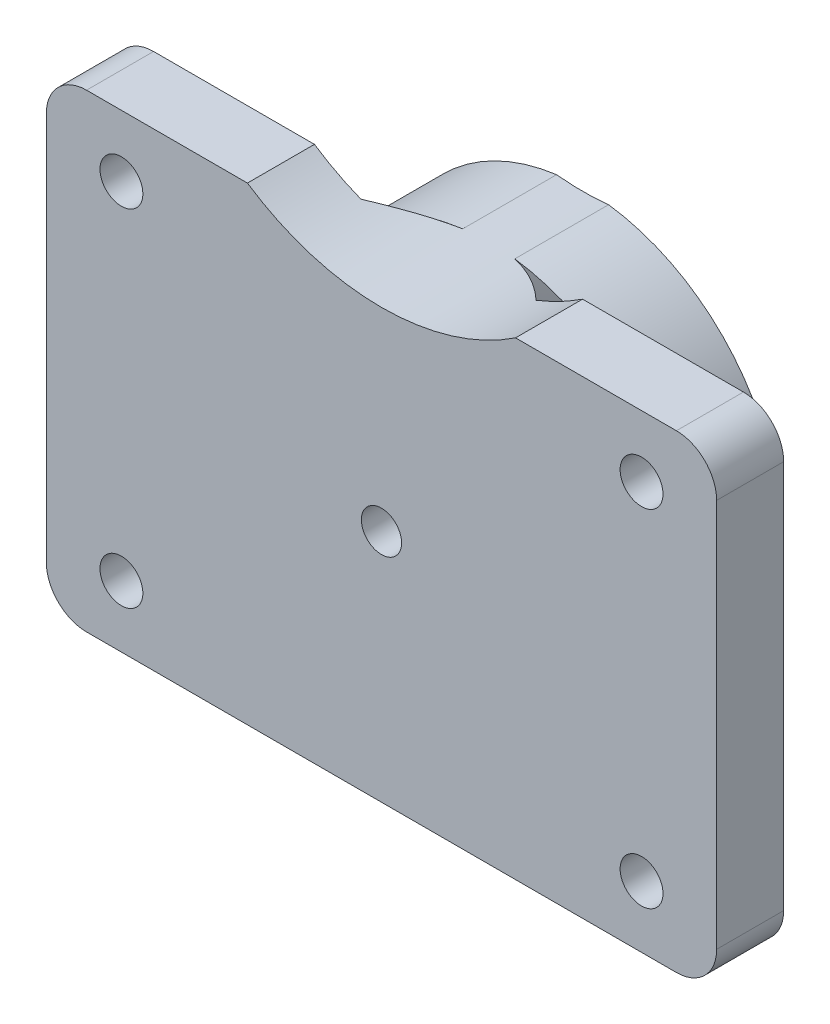
from build123d import *

# Parameters (mm, degrees)
CROQUIS1_R              = 1.6
SALIENTE_EXTRUIR1_DEPTH = 2.5
CROQUIS3_R              = 1.5
CORTAR_EXTRUIR1_DEPTH   = 5
CORTAR_EXTRUIR2_DEPTH   = 25


with BuildPart() as part:
    # Croquis1 → Saliente-Extruir1 (new, symmetric)
    with BuildSketch(Plane.XY):
        with BuildLine():
            Line((-22, -17.5), (22, -17.5))
            ThreePointArc((22, -17.5), (24.121320344, -16.621320344), (25, -14.5))
            Line((25, -14.5), (25, 14.5))
            ThreePointArc((25, 14.5), (24.121320344, 16.621320344), (22, 17.5))
            Line((22, 17.5), (-22, 17.5))
            ThreePointArc((-22, 17.5), (-24.121320344, 16.621320344), (-25, 14.5))
            Line((-25, 14.5), (-25, -14.5))
            ThreePointArc((-25, -14.5), (-24.121320344, -16.621320344), (-22, -17.5))
        make_face()
        with Locations((-19.4, 12.9)):
            Circle(CROQUIS1_R, mode=Mode.SUBTRACT)
        with Locations(Location((19.4, 12.9, 0), (0, 0, 180))):
            Circle(CROQUIS1_R, mode=Mode.SUBTRACT)
        with Locations((19.4, -12.9)):
            Circle(CROQUIS1_R, mode=Mode.SUBTRACT)
        with Locations(Location((-19.4, -12.9, 0), (0, 0, 180))):
            Circle(CROQUIS1_R, mode=Mode.SUBTRACT)
    extrude(amount=SALIENTE_EXTRUIR1_DEPTH, both=True)

    # Croquis2 → Revolución1 (revolve)
    with BuildSketch(Plane(origin=(0, 0, 0), x_dir=(1, 0, 0), z_dir=(0, 1, 0))):
        Polygon((8.2, 2.5), (8.2, 12.5), (14.7, 12.5), (14.7, 5.5), (17, 2.5), align=None)
    revolve(axis=Axis((0, 0, 7.417580073), (0, 0, -1)))

    # Croquis3 → Cortar-Extruir1 (cut)
    with BuildSketch(Plane(origin=(0, 0, -2.5), x_dir=(-1, 0, 0), z_dir=(0, 0, -1))):
        Circle(CROQUIS3_R)
    extrude(amount=-CORTAR_EXTRUIR1_DEPTH, mode=Mode.SUBTRACT)

    # Croquis4 → Cortar-Extruir2 (cut)
    with BuildSketch(Plane.XY.offset(2.5)):
        with BuildLine():
            Line((-10, 17.5), (10, 17.5))
            ThreePointArc((10, 17.5), (0, 14.466629547), (-10, 17.5))
        make_face()
    extrude(amount=-CORTAR_EXTRUIR2_DEPTH, mode=Mode.SUBTRACT)


solid = part.part
